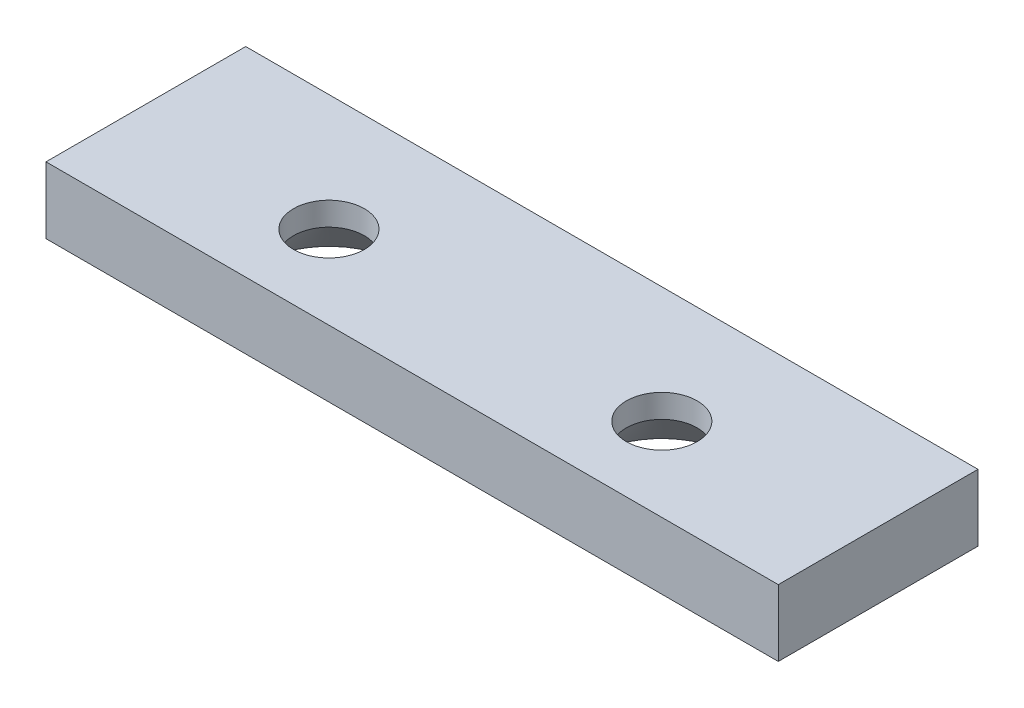
from build123d import *

# Parameters (mm, degrees)
SKETCH1_W                                        = 69.85
SKETCH1_H                                        = 19.05
BOSS_EXTRUDE1_DEPTH                              = 6.35
CSK_FOR_1_4_FLAT_HEAD_MACHINE_SCREW1_D           = 6.7564
CSK_FOR_1_4_FLAT_HEAD_MACHINE_SCREW1_DEPTH       = 15.24
CSK_FOR_1_4_FLAT_HEAD_MACHINE_SCREW1_CSINK_D     = 13.9192
CSK_FOR_1_4_FLAT_HEAD_MACHINE_SCREW1_CSINK_ANGLE = 82
CSK_FOR_1_4_FLAT_HEAD_MACHINE_SCREW1_TIP         = 2.029827343


with BuildPart() as part:
    # Sketch1 → Boss-Extrude1 (new body)
    with BuildSketch(Plane(origin=(0, 0, 0), x_dir=(1, 0, 0), z_dir=(0, 1, 0))):
        Rectangle(SKETCH1_W, SKETCH1_H)
    extrude(amount=BOSS_EXTRUDE1_DEPTH)

    # CSK for 1/4 Flat Head Machine Screw1
    with Locations(Plane(origin=(0, 0, 0), x_dir=(-1, 0, 0), z_dir=(0, -1, 0))):
        with Locations((15.875, -1.5875), (-15.875, -1.5875)):
            CounterSinkHole(CSK_FOR_1_4_FLAT_HEAD_MACHINE_SCREW1_D / 2, CSK_FOR_1_4_FLAT_HEAD_MACHINE_SCREW1_CSINK_D / 2, depth=CSK_FOR_1_4_FLAT_HEAD_MACHINE_SCREW1_DEPTH, counter_sink_angle=CSK_FOR_1_4_FLAT_HEAD_MACHINE_SCREW1_CSINK_ANGLE)
            with Locations((0, 0, -(CSK_FOR_1_4_FLAT_HEAD_MACHINE_SCREW1_DEPTH + CSK_FOR_1_4_FLAT_HEAD_MACHINE_SCREW1_TIP / 2))):  # 118° drill point
                Cone(0, CSK_FOR_1_4_FLAT_HEAD_MACHINE_SCREW1_D / 2, CSK_FOR_1_4_FLAT_HEAD_MACHINE_SCREW1_TIP, mode=Mode.SUBTRACT)


solid = part.part
